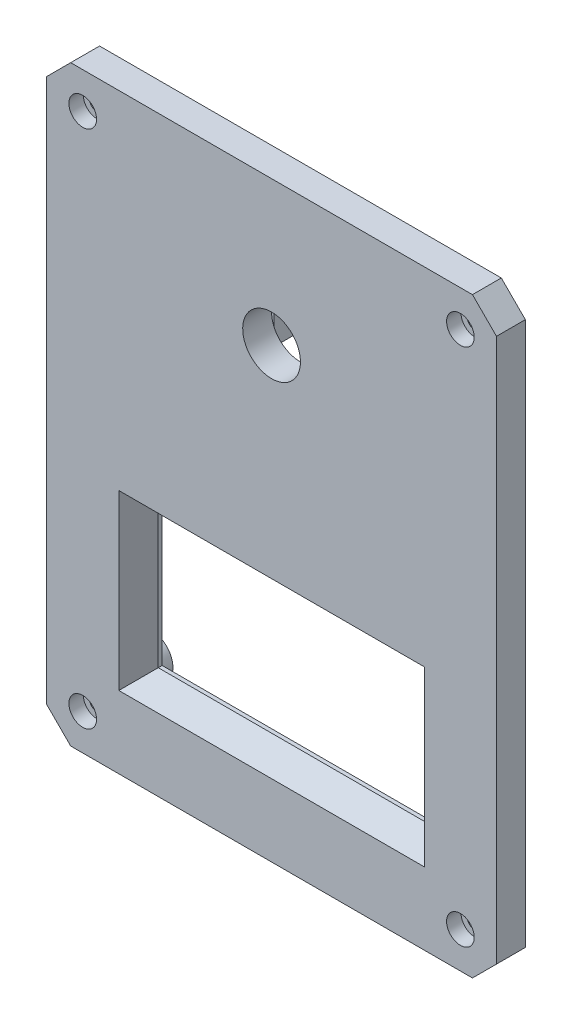
from build123d import *

# Parameters (mm, degrees)
SKETCH1_W           = 93.5
SKETCH1_H           = 123
SKETCH1_R           = 6
SKETCH1_W_2         = 57.5
SKETCH1_H_2         = 30
BOSS_EXTRUDE1_DEPTH = 6
SKETCH2_R           = 4.5
SKETCH2_R_2         = 2.1
BOSS_EXTRUDE2_DEPTH = 3
CHAMFER2_SIZE       = 5
SKETCH5_R           = 2.875
CUT_EXTRUDE2_DEPTH  = 3
SKETCH6_R           = 1.625
CUT_EXTRUDE3_DEPTH  = 23
SKETCH7_W           = 5
SKETCH7_H           = 12
SKETCH7_W_2         = 8
SKETCH7_H_2         = 24.8
SKETCH7_R           = 2.1
BOSS_EXTRUDE3_DEPTH = 6
CHAMFER3_SIZE       = 3
CHAMFER3_SIZE2      = 5.196152423
SKETCH9_R           = 2.1
CUT_EXTRUDE5_DEPTH  = 3


with BuildPart() as part:
    # Sketch1 → Boss-Extrude1 (new body)
    with BuildSketch(Plane.XY):
        with Locations((0, 28.5)):
            Rectangle(SKETCH1_W, SKETCH1_H)
        with Locations((0, 60)):
            Circle(SKETCH1_R, mode=Mode.SUBTRACT)
        Rectangle(SKETCH1_W_2, SKETCH1_H_2, mode=Mode.SUBTRACT)
    extrude(amount=BOSS_EXTRUDE1_DEPTH)

    # Sketch2 → Boss-Extrude2 (add)
    # profile 1 of 4: a face of its own
    with BuildSketch(Plane(origin=(0, 0, 0), x_dir=(-1, 0, 0), z_dir=(0, 0, -1))):
        with Locations((34, 21.75)):
            Circle(SKETCH2_R)
        with Locations((34, 21.75)):
            Circle(SKETCH2_R_2, mode=Mode.SUBTRACT)
    # profile 2 of 4: a face of its own
    with BuildSketch(Plane(origin=(0, 0, 0), x_dir=(-1, 0, 0), z_dir=(0, 0, -1))):
        with Locations((-34, -17.25)):
            Circle(SKETCH2_R)
        with Locations((-34, -17.25)):
            Circle(SKETCH2_R_2, mode=Mode.SUBTRACT)
    # profile 3 of 4: a face of its own
    with BuildSketch(Plane(origin=(0, 0, 0), x_dir=(-1, 0, 0), z_dir=(0, 0, -1))):
        with Locations((34, -17.25)):
            Circle(SKETCH2_R)
        with Locations((34, -17.25)):
            Circle(SKETCH2_R_2, mode=Mode.SUBTRACT)
    # profile 4 of 4: a face of its own
    with BuildSketch(Plane(origin=(0, 0, 0), x_dir=(-1, 0, 0), z_dir=(0, 0, -1))):
        with Locations((-34, 21.75)):
            Circle(SKETCH2_R)
        with Locations((-34, 21.75)):
            Circle(SKETCH2_R_2, mode=Mode.SUBTRACT)
    extrude(amount=BOSS_EXTRUDE2_DEPTH)

    # Chamfer2
    chamfer2_edges = [part.edges().sort_by_distance(p)[0] for p in [
        (-46.75, 90, 3),
        (46.75, 90, 3),
        (46.75, -33, 3),
        (-46.75, -33, 3),
    ]]
    chamfer(chamfer2_edges, length=CHAMFER2_SIZE)

    # Sketch5 → Cut-Extrude2 (cut)
    with BuildSketch(Plane.XY.offset(6)):
        with Locations((39.25, -25.5)):
            Circle(SKETCH5_R)
        with Locations((39.25, 82.5)):
            Circle(SKETCH5_R)
        with Locations(Location((-39.25, -25.5, 0), (0, 0, 180))):
            Circle(SKETCH5_R)
        with Locations(Location((-39.25, 82.5, 0), (0, 0, 180))):
            Circle(SKETCH5_R)
    extrude(amount=-CUT_EXTRUDE2_DEPTH, mode=Mode.SUBTRACT)

    # Sketch6 → Cut-Extrude3 (cut)
    with BuildSketch(Plane.XY.offset(3)):
        with Locations((39.25, -25.5)):
            Circle(SKETCH6_R)
        with Locations((-39.25, -25.5)):
            Circle(SKETCH6_R)
        with Locations((-39.25, 82.5)):
            Circle(SKETCH6_R)
        with Locations((39.25, 82.5)):
            Circle(SKETCH6_R)
    extrude(amount=-CUT_EXTRUDE3_DEPTH, mode=Mode.SUBTRACT)

    # Sketch7 → Boss-Extrude3 (add)
    # profile 1 of 2: a face of its own
    with BuildSketch(Plane.XY):
        with Locations((-8, 60)):
            Rectangle(SKETCH7_W, SKETCH7_H)
    # profile 2 of 2: a face of its own
    with BuildSketch(Plane.XY):
        with Locations((9.5, 60)):
            Rectangle(SKETCH7_W_2, SKETCH7_H_2)
        with Locations((8, 51.6)):
            Circle(SKETCH7_R, mode=Mode.SUBTRACT)
        with Locations((8, 68.4)):
            Circle(SKETCH7_R, mode=Mode.SUBTRACT)
    extrude(amount=-BOSS_EXTRUDE3_DEPTH)

    # Chamfer3
    chamfer3_edges = [part.edges().sort_by_distance(p)[0] for p in [
        (-28.75, 0, 6),
        (0, -15, 6),
        (28.75, 0, 6),
        (0, 15, 6),
    ]]
    chamfer3_side = [part.faces().sort_by_distance(p)[0] for p in [
        (0, 33.295685128, 6),
    ]]
    chamfer(chamfer3_edges, length=CHAMFER3_SIZE, length2=CHAMFER3_SIZE2, reference=chamfer3_side[0])

    # Sketch9 → Cut-Extrude5 (cut)
    with BuildSketch(Plane(origin=(0, 0, 0), x_dir=(-1, 0, 0), z_dir=(0, 0, -1))):
        with Locations((30, 75)):
            Circle(SKETCH9_R)
        with Locations((30, 45)):
            Circle(SKETCH9_R)
        with Locations(Location((-30, 45, 0), (0, 0, 180))):
            Circle(SKETCH9_R)
        with Locations(Location((-30, 75, 0), (0, 0, 180))):
            Circle(SKETCH9_R)
    extrude(amount=-CUT_EXTRUDE5_DEPTH, mode=Mode.SUBTRACT)


solid = part.part
